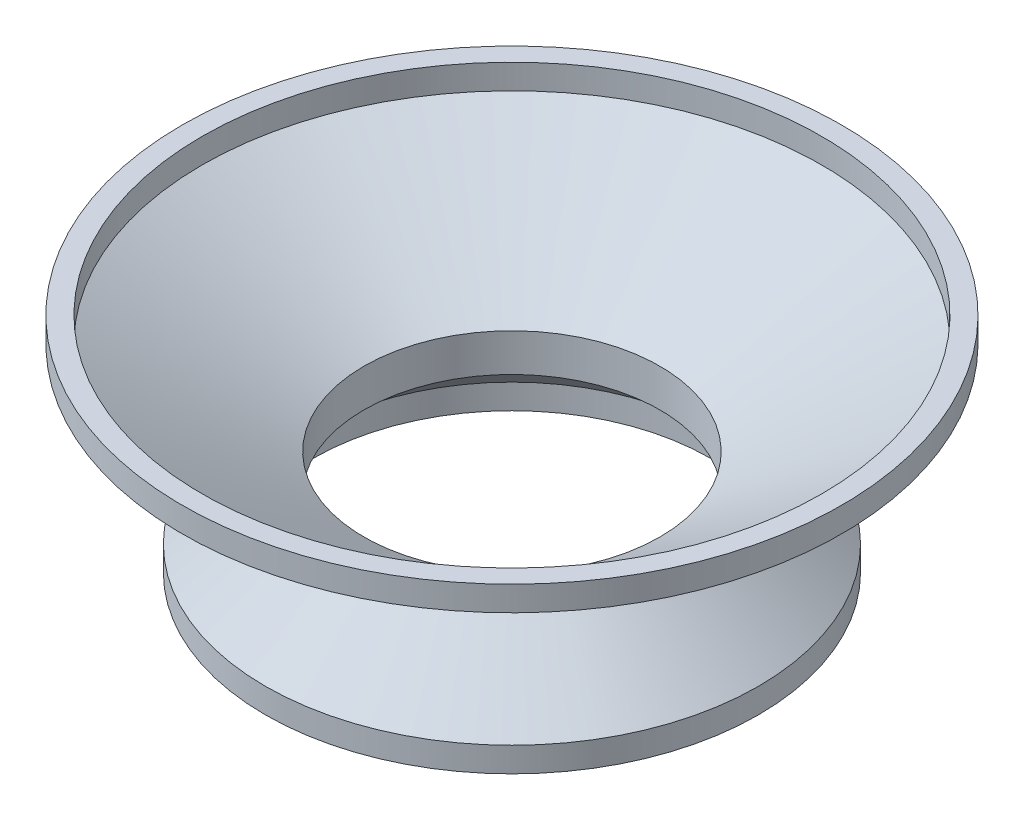
from build123d import *

# Parameters (mm, degrees)
FILLET2_R           = 0.4
SKETCH2_R           = 26.6
SKETCH2_R_2         = 25
BOSS_EXTRUDE1_DEPTH = 2
SKETCH3_R           = 19.894115095
SKETCH3_R_2         = 16.004805528
BOSS_EXTRUDE2_DEPTH = 2


with BuildPart() as part:
    # Sketch1 → Revolve1 (revolve)
    with BuildSketch(Plane.XY):
        Polygon((0.662781953, 0), (-13.193624508, 8), (-11.593624508, 8), (1.462781953, 0.461880215), (1.462781953, -2.592238518), (-2.598430036, -6), (-6.487739603, -6), align=None)
    revolve(axis=Axis((13.406375492, 7.609018033, 0), (0, -1, 0)))

    # Fillet2
    fillet2_edges = [part.edges().sort_by_distance(p)[0] for p in [
        (26.149969032, 0, 0),
    ]]
    fillet(fillet2_edges, radius=FILLET2_R)

    # Sketch2 → Boss-Extrude1 (add)
    with BuildSketch(Plane(origin=(0, 8, 0), x_dir=(1, 0, 0), z_dir=(0, 1, 0))):
        with Locations(Location((13.406375492, 0, 0), (0, 0, 180))):
            Circle(SKETCH2_R)
        with Locations(Location((13.406375492, 0, 0), (0, 0, 180))):
            Circle(SKETCH2_R_2, mode=Mode.SUBTRACT)
    extrude(amount=BOSS_EXTRUDE1_DEPTH)

    # Sketch3 → Boss-Extrude2 (add)
    with BuildSketch(Plane.XZ.offset(6)):
        with Locations((13.406375492, 0)):
            Circle(SKETCH3_R)
        with Locations(Location((13.406375492, 0, 0), (0, 0, 180))):
            Circle(SKETCH3_R_2, mode=Mode.SUBTRACT)
    extrude(amount=BOSS_EXTRUDE2_DEPTH)


solid = part.part
